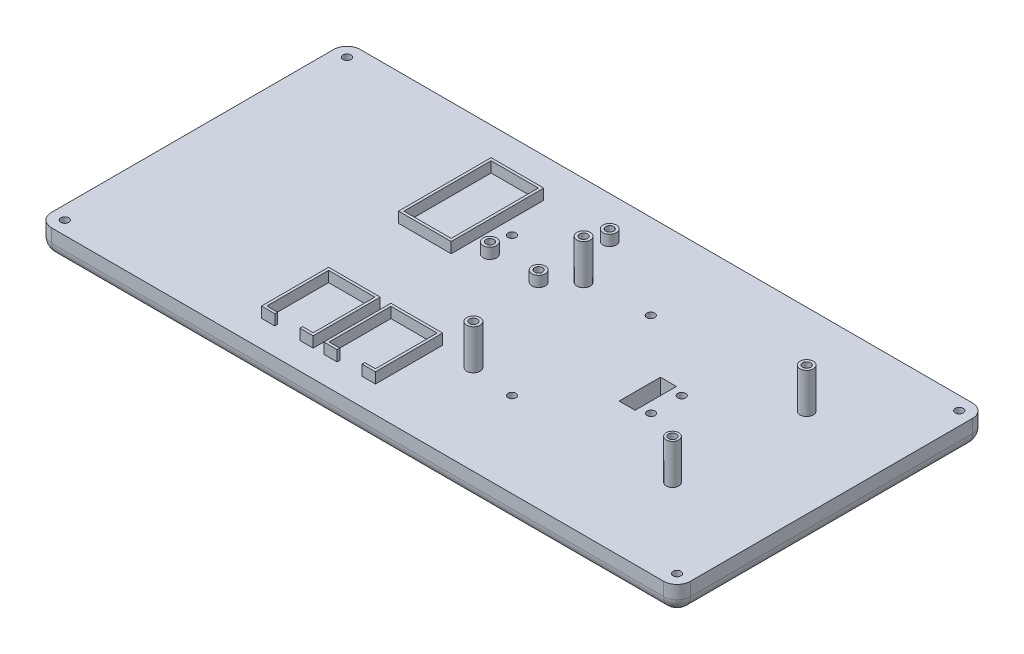
from build123d import *

# Parameters (mm, degrees)
SKETCH1_W                      = 240
SKETCH1_H                      = 116
BOSS_EXTRUDE1_DEPTH            = 10
SKETCH2_W                      = 62.15
SKETCH2_H                      = 62.15
CUT_EXTRUDE1_DEPTH             = 2.5
CUT_EXTRUDE2_REACH             = 135.493
SKETCH3_R                      = 1.5
SKETCH4_W                      = 12
SKETCH4_H                      = 15.5
CUT_EXTRUDE3_DEPTH             = 2.5
CUT_EXTRUDE4_REACH             = 135.493
SKETCH6_R                      = 1.5
CUT_EXTRUDE4_DIRECTION_2_DEPTH = 134.492509153
CUT_EXTRUDE5_REACH             = 135.493
SKETCH7_W                      = 6
SKETCH7_H                      = 15.5
SKETCH8_R                      = 2.5
SKETCH8_R_2                    = 1.5
SKETCH8_R_3                    = 2.347298944
BOSS_EXTRUDE2_DEPTH            = 15
SKETCH9_R                      = 2.5
SKETCH9_R_2                    = 1.5
SKETCH9_W                      = 19.78
SKETCH9_H                      = 34.766
SKETCH9_W_2                    = 17.78
SKETCH9_H_2                    = 32.766
BOSS_EXTRUDE3_DEPTH            = 4
FILLET1_R                      = 5
CUT_EXTRUDE15_REACH            = 136.123
SKETCH25_R                     = 1.5


with BuildPart() as part:
    # Sketch1 → Boss-Extrude1 (new body)
    with BuildSketch(Plane(origin=(0, 0, 0), x_dir=(1, 0, 0), z_dir=(0, 1, 0))):
        Rectangle(SKETCH1_W, SKETCH1_H)
    extrude(amount=BOSS_EXTRUDE1_DEPTH)

    # Sketch2 → Cut-Extrude1 (cut)
    with BuildSketch(Plane.XZ):
        Rectangle(SKETCH2_W, SKETCH2_H)
    extrude(amount=-CUT_EXTRUDE1_DEPTH, mode=Mode.SUBTRACT)

    # Sketch3 → Cut-Extrude2 (cut, up to next)
    with BuildSketch(Plane.XZ.offset(-2.5), mode=Mode.PRIVATE) as cut_extrude2_sk1:
        with Locations(Location((-26.075, 26.075, 0), (0, 0, 270))):
            Circle(SKETCH3_R)
    cut_extrude2_tool1 = extrude(cut_extrude2_sk1.sketch, amount=-CUT_EXTRUDE2_REACH, mode=Mode.PRIVATE) & part.part
    # Sketch3 → Cut-Extrude2 (cut, up to next)
    with BuildSketch(Plane.XZ.offset(-2.5), mode=Mode.PRIVATE) as cut_extrude2_sk2:
        with Locations(Location((-26.075, -26.075, 0), (0, 0, 90))):
            Circle(SKETCH3_R)
    cut_extrude2_tool2 = extrude(cut_extrude2_sk2.sketch, amount=-CUT_EXTRUDE2_REACH, mode=Mode.PRIVATE) & part.part
    # Sketch3 → Cut-Extrude2 (cut, up to next)
    with BuildSketch(Plane.XZ.offset(-2.5), mode=Mode.PRIVATE) as cut_extrude2_sk3:
        with Locations(Location((26.075, -26.075, 0), (0, 0, 270))):
            Circle(SKETCH3_R)
    cut_extrude2_tool3 = extrude(cut_extrude2_sk3.sketch, amount=-CUT_EXTRUDE2_REACH, mode=Mode.PRIVATE) & part.part
    # Sketch3 → Cut-Extrude2 (cut, up to next)
    with BuildSketch(Plane.XZ.offset(-2.5), mode=Mode.PRIVATE) as cut_extrude2_sk4:
        with Locations(Location((26.075, 26.075, 0), (0, 0, 90))):
            Circle(SKETCH3_R)
    cut_extrude2_tool4 = extrude(cut_extrude2_sk4.sketch, amount=-CUT_EXTRUDE2_REACH, mode=Mode.PRIVATE) & part.part
    add(cut_extrude2_tool1.solids().sort_by_distance((-26.075, 2.5, 26.075))[0], mode=Mode.SUBTRACT)
    add(cut_extrude2_tool2.solids().sort_by_distance((-26.075, 2.5, -26.075))[0], mode=Mode.SUBTRACT)
    add(cut_extrude2_tool3.solids().sort_by_distance((26.075, 2.5, -26.075))[0], mode=Mode.SUBTRACT)
    add(cut_extrude2_tool4.solids().sort_by_distance((26.075, 2.5, 26.075))[0], mode=Mode.SUBTRACT)

    # Sketch4 → Cut-Extrude3 (cut)
    with BuildSketch(Plane.XZ):
        with Locations((54, 0)):
            Rectangle(SKETCH4_W, SKETCH4_H)
    extrude(amount=-CUT_EXTRUDE3_DEPTH, mode=Mode.SUBTRACT)

    # Sketch6 → Cut-Extrude4 (cut, up to next)
    with BuildSketch(Plane.XZ.offset(-2.5), mode=Mode.PRIVATE) as cut_extrude4_sk1:
        with Locations(Location((58, 5.75, 0), (0, 0, 90))):
            Circle(SKETCH6_R)
    cut_extrude4_tool1 = extrude(cut_extrude4_sk1.sketch, amount=-CUT_EXTRUDE4_REACH, mode=Mode.PRIVATE) & part.part
    # Sketch6 → Cut-Extrude4 (cut, up to next)
    with BuildSketch(Plane.XZ.offset(-2.5), mode=Mode.PRIVATE) as cut_extrude4_sk2:
        with Locations(Location((58, -5.75, 0), (0, 0, 90))):
            Circle(SKETCH6_R)
    cut_extrude4_tool2 = extrude(cut_extrude4_sk2.sketch, amount=-CUT_EXTRUDE4_REACH, mode=Mode.PRIVATE) & part.part
    add(cut_extrude4_tool1.solids().sort_by_distance((58, 2.5, 5.75))[0], mode=Mode.SUBTRACT)
    add(cut_extrude4_tool2.solids().sort_by_distance((58, 2.5, -5.75))[0], mode=Mode.SUBTRACT)

    # Sketch6 → Cut-Extrude4 direction 2 (cut)
    with BuildSketch(Plane.XZ.offset(-2.5)):
        with Locations(Location((58, 5.75, 0), (0, 0, 90))):
            Circle(SKETCH6_R)
        with Locations(Location((58, -5.75, 0), (0, 0, 90))):
            Circle(SKETCH6_R)
    extrude(amount=CUT_EXTRUDE4_DIRECTION_2_DEPTH, mode=Mode.SUBTRACT)

    # Sketch7 → Cut-Extrude5 (cut, up to next)
    with BuildSketch(Plane.XZ.offset(-2.5), mode=Mode.PRIVATE) as cut_extrude5_sk1:
        with Locations((51, 0)):
            Rectangle(SKETCH7_W, SKETCH7_H)
    cut_extrude5_tool1 = extrude(cut_extrude5_sk1.sketch, amount=-CUT_EXTRUDE5_REACH, mode=Mode.PRIVATE) & part.part
    add(cut_extrude5_tool1.solids().sort_by_distance((51, 2.5, 0))[0], mode=Mode.SUBTRACT)

    # Sketch8 → Boss-Extrude2 (add)
    # profile 1 of 4: a face of its own
    with BuildSketch(Plane(origin=(0, 10, 0), x_dir=(1, 0, 0), z_dir=(0, 1, 0))):
        with Locations(Location((86.5, 24.2, 0), (0, 0, 270))):
            Circle(SKETCH8_R)
        with Locations(Location((86.5, 24.2, 0), (0, 0, 270))):
            Circle(SKETCH8_R_2, mode=Mode.SUBTRACT)
    # profile 2 of 4: a face of its own
    with BuildSketch(Plane(origin=(0, 10, 0), x_dir=(1, 0, 0), z_dir=(0, 1, 0))):
        with Locations(Location((84.5, -24.2, 0), (0, 0, 270))):
            Circle(SKETCH8_R_3)
        with Locations(Location((84.5, -24.2, 0), (0, 0, 270))):
            Circle(SKETCH8_R_2, mode=Mode.SUBTRACT)
    # profile 3 of 4: a face of its own
    with BuildSketch(Plane(origin=(0, 10, 0), x_dir=(1, 0, 0), z_dir=(0, 1, 0))):
        with Locations(Location((9.7, -24.2, 0), (0, 0, 270))):
            Circle(SKETCH8_R)
        with Locations(Location((9.7, -24.2, 0), (0, 0, 270))):
            Circle(SKETCH8_R_2, mode=Mode.SUBTRACT)
    # profile 4 of 4: a face of its own
    with BuildSketch(Plane(origin=(0, 10, 0), x_dir=(1, 0, 0), z_dir=(0, 1, 0))):
        with Locations(Location((2.7, 24.2, 0), (0, 0, 270))):
            Circle(SKETCH8_R)
        with Locations(Location((2.7, 24.2, 0), (0, 0, 270))):
            Circle(SKETCH8_R_2, mode=Mode.SUBTRACT)
    extrude(amount=BOSS_EXTRUDE2_DEPTH)

    # Sketch9 → Boss-Extrude3 (add)
    # profile 1 of 6: a face of its own
    with BuildSketch(Plane(origin=(0, 10, 0), x_dir=(1, 0, 0), z_dir=(0, 1, 0))):
        with Locations(Location((-24.1, 15.8, 0), (0, 0, 270))):
            Circle(SKETCH9_R)
        with Locations(Location((-24.1, 15.8, 0), (0, 0, 270))):
            Circle(SKETCH9_R_2, mode=Mode.SUBTRACT)
    # profile 2 of 6: a face of its own
    with BuildSketch(Plane(origin=(0, 10, 0), x_dir=(1, 0, 0), z_dir=(0, 1, 0))):
        with Locations(Location((-5.8, 15.8, 0), (0, 0, 270))):
            Circle(SKETCH9_R)
        with Locations(Location((-5.8, 15.8, 0), (0, 0, 270))):
            Circle(SKETCH9_R_2, mode=Mode.SUBTRACT)
    # profile 3 of 6: a face of its own
    with BuildSketch(Plane(origin=(0, 10, 0), x_dir=(1, 0, 0), z_dir=(0, 1, 0))):
        with Locations(Location((-5.8, 42.5, 0), (0, 0, 270))):
            Circle(SKETCH9_R)
        with Locations(Location((-5.8, 42.5, 0), (0, 0, 270))):
            Circle(SKETCH9_R_2, mode=Mode.SUBTRACT)
    # profile 4 of 6: a face of its own
    with BuildSketch(Plane(origin=(0, 10, 0), x_dir=(1, 0, 0), z_dir=(0, 1, 0))):
        Polygon((-17.7, -47), (-17.7, -48), (-22.7, -48), (-22.7, -22.8), (-3.3, -22.8), (-3.3, -48), (-8.3, -48), (-8.3, -47), (-4.3, -47), (-4.3, -23.8), (-21.7, -23.8), (-21.7, -47), align=None)
    # profile 5 of 6: a face of its own
    with BuildSketch(Plane(origin=(0, 10, 0), x_dir=(1, 0, 0), z_dir=(0, 1, 0))):
        Polygon((-41.1, -48), (-46.1, -48), (-46.1, -22.8), (-26.7, -22.8), (-26.7, -48), (-31.7, -48), (-31.7, -47), (-27.7, -47), (-27.7, -23.8), (-45.1, -23.8), (-45.1, -47), (-41.1, -47), align=None)
    # profile 6 of 6: a face of its own
    with BuildSketch(Plane(origin=(0, 10, 0), x_dir=(1, 0, 0), z_dir=(0, 1, 0))):
        with Locations((-41.35, 26)):
            Rectangle(SKETCH9_W, SKETCH9_H)
        with Locations((-41.35, 26)):
            Rectangle(SKETCH9_W_2, SKETCH9_H_2, mode=Mode.SUBTRACT)
    extrude(amount=BOSS_EXTRUDE3_DEPTH)

    # Fillet1
    fillet1_edges = [part.edges().sort_by_distance(p)[0] for p in [
        (0, 0, 58),
        (-120, 0, 0),
        (0, 0, -58),
        (120, 0, 0),
        (120, 5, 58),
        (-120, 5, 58),
        (-120, 5, -58),
        (120, 5, -58),
    ]]
    fillet(fillet1_edges, radius=FILLET1_R)

    # Sketch25 → Cut-Extrude15 (cut, up to next)
    with BuildSketch(Plane(origin=(0, 10, 0), x_dir=(1, 0, 0), z_dir=(0, 1, 0)), mode=Mode.PRIVATE) as cut_extrude15_sk1:
        with Locations(Location((-115, 53, 0), (0, 0, 270))):
            Circle(SKETCH25_R)
    cut_extrude15_tool1 = extrude(cut_extrude15_sk1.sketch, amount=-CUT_EXTRUDE15_REACH, mode=Mode.PRIVATE) & part.part
    # Sketch25 → Cut-Extrude15 (cut, up to next)
    with BuildSketch(Plane(origin=(0, 10, 0), x_dir=(1, 0, 0), z_dir=(0, 1, 0)), mode=Mode.PRIVATE) as cut_extrude15_sk2:
        with Locations(Location((-115, -53, 0), (0, 0, 270))):
            Circle(SKETCH25_R)
    cut_extrude15_tool2 = extrude(cut_extrude15_sk2.sketch, amount=-CUT_EXTRUDE15_REACH, mode=Mode.PRIVATE) & part.part
    # Sketch25 → Cut-Extrude15 (cut, up to next)
    with BuildSketch(Plane(origin=(0, 10, 0), x_dir=(1, 0, 0), z_dir=(0, 1, 0)), mode=Mode.PRIVATE) as cut_extrude15_sk3:
        with Locations(Location((115, -53, 0), (0, 0, 270))):
            Circle(SKETCH25_R)
    cut_extrude15_tool3 = extrude(cut_extrude15_sk3.sketch, amount=-CUT_EXTRUDE15_REACH, mode=Mode.PRIVATE) & part.part
    # Sketch25 → Cut-Extrude15 (cut, up to next)
    with BuildSketch(Plane(origin=(0, 10, 0), x_dir=(1, 0, 0), z_dir=(0, 1, 0)), mode=Mode.PRIVATE) as cut_extrude15_sk4:
        with Locations(Location((115, 53, 0), (0, 0, 270))):
            Circle(SKETCH25_R)
    cut_extrude15_tool4 = extrude(cut_extrude15_sk4.sketch, amount=-CUT_EXTRUDE15_REACH, mode=Mode.PRIVATE) & part.part
    add(cut_extrude15_tool1.solids().sort_by_distance((-115, 10, -53))[0], mode=Mode.SUBTRACT)
    add(cut_extrude15_tool2.solids().sort_by_distance((-115, 10, 53))[0], mode=Mode.SUBTRACT)
    add(cut_extrude15_tool3.solids().sort_by_distance((115, 10, 53))[0], mode=Mode.SUBTRACT)
    add(cut_extrude15_tool4.solids().sort_by_distance((115, 10, -53))[0], mode=Mode.SUBTRACT)


solid = part.part
